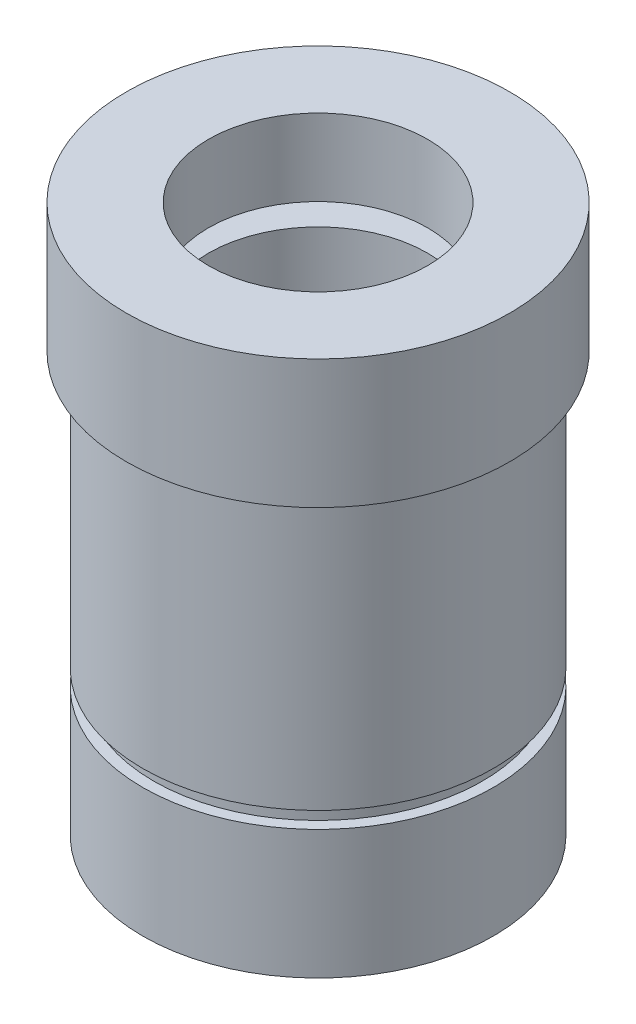
from build123d import *

# Parameters (mm, degrees)
SKETCH2_R          = 10
CUT_EXTRUDE1_DEPTH = 56.789784011
SKETCH3_R          = 13
CUT_EXTRUDE2_DEPTH = 2
CUT_EXTRUDE3_START = -2
SKETCH4_R          = 13
CUT_EXTRUDE3_DEPTH = 2


with BuildPart() as part:
    # Sketch1 → Revolve1 (revolve)
    with BuildSketch(Plane.XY, mode=Mode.PRIVATE) as revolve1_sk:
        Polygon((0, 23.132117765), (17.5, 23.132117765), (17.5, 11.382117765), (16, 11.382117765), (16, -13.617882235), (15, -13.617882235), (15, -15.117882235), (16, -15.117882235), (16, -26.867882235), (0, -26.867882235), align=None)
    revolve(revolve1_sk.sketch.rotate(Axis((0, 23.362720403, 0), (0, -1, 0)), 90), axis=Axis((0, 23.362720403, 0), (0, -1, 0)))

    # Sketch2 → Cut-Extrude1 (cut, through all)
    with BuildSketch(Plane(origin=(0, 23.132117765, 0), x_dir=(1, 0, 0), z_dir=(0, 1, 0))):
        with Locations(Location((0, 0, 0), (0, 0, 270))):
            Circle(SKETCH2_R)
    extrude(amount=-CUT_EXTRUDE1_DEPTH, mode=Mode.SUBTRACT)

    # Sketch3 → Cut-Extrude2 (cut)
    with BuildSketch(Plane(origin=(0, 16.132117765, 0), x_dir=(1, 0, 0), z_dir=(0, 1, 0))):
        with Locations(Location((0, 0, 0), (0, 0, 270))):
            Circle(SKETCH3_R)
    extrude(amount=-CUT_EXTRUDE2_DEPTH, mode=Mode.SUBTRACT)

    # Sketch4 → Cut-Extrude3 (cut)
    with BuildSketch(Plane(origin=(0, -19.867882235, 0), x_dir=(-1, 0, 0), z_dir=(0, -1, 0)).offset(CUT_EXTRUDE3_START)):
        with Locations(Location((0, 0, 0), (0, 0, 270))):
            Circle(SKETCH4_R)
    extrude(amount=CUT_EXTRUDE3_DEPTH, mode=Mode.SUBTRACT)


solid = part.part
